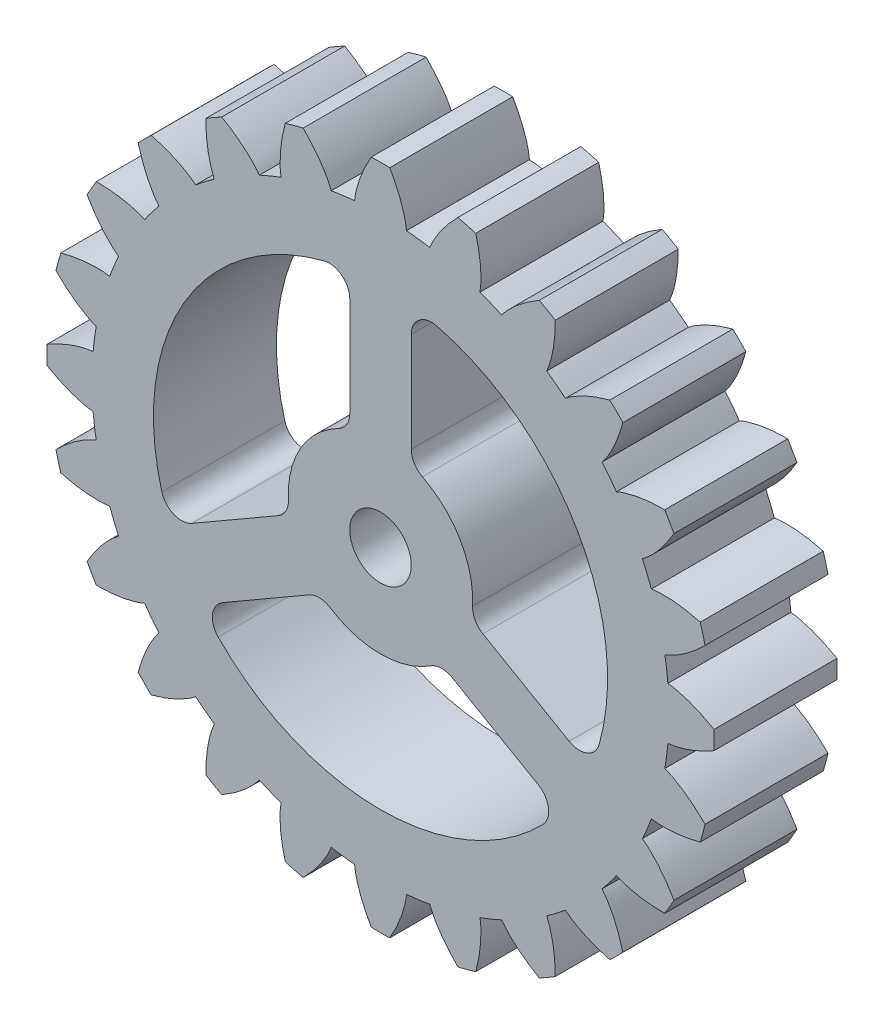
from build123d import *
from build123d.topology import SkipClean

# Parameters (mm, degrees)
SKETCH5_R            = 14.078874537
SKETCH5_R_2          = 1.5
EXTRUDE_BODY_DEPTH   = 3
EXTRUDE_TOOTH_DEPTH  = 3
CIRPATTERN1_COUNT    = 24
CUT_SPOKE_DEPTH      = 24.21644933
PATTERN_SPOKES_COUNT = 3


with BuildPart() as part:
    # Sketch5 → Extrude Body (new, symmetric)
    with BuildSketch(Plane.XY):
        Circle(SKETCH5_R)
        Circle(SKETCH5_R_2, mode=Mode.SUBTRACT)
    extrude(amount=EXTRUDE_BODY_DEPTH, both=True)

    # Sketch6 → Extrude Tooth (add, symmetric)
    with BuildSketch(Plane.XY):
        with BuildLine():
            Line((1.274269027, 13.788607604), (0.138033757, 1.493635391))
            ThreePointArc((0.138033757, 1.493635391), (0, 1.5), (-0.138033757, 1.493635391))
            Line((-0.138033757, 1.493635391), (-1.274269027, 13.788607604))
            add(Edge.make_bspline(
                [(-1.274269027, 13.788607604), (-1.281655886, 14.009204475), (-1.145793676, 14.886152234), (-0.779387603, 15.700986555), (-0.45055771, 16.272638198)],
                knots=[0, 0, 0, 0, 0.250018961, 1, 1, 1, 1], degree=3))
            ThreePointArc((-0.45055771, 16.272638198), (0, 16.278874537), (0.45055771, 16.272638198))
            add(Edge.make_bspline(
                [(1.274269027, 13.788607604), (1.281655886, 14.009204475), (1.145793676, 14.886152234), (0.779387603, 15.700986555), (0.45055771, 16.272638198)],
                knots=[0, 0, 0, 0, 0.250018961, 1, 1, 1, 1], degree=3))
        make_face()
    extrude_tooth = extrude(amount=EXTRUDE_TOOTH_DEPTH, both=True)

    # CirPattern1: Extrude Tooth ×24 about axis
    with SkipClean():  # the faces are left unmerged after this step: merging them gives an invalid solid
        cirpattern1_axis = Axis((0, 0, 3), (0, 0, -1))
        for i in range(1, CIRPATTERN1_COUNT):
            add(extrude_tooth.rotate(cirpattern1_axis, i * 360 / CIRPATTERN1_COUNT))

    # Sketch8 → Cut Spoke (cut, symmetric)
    with SkipClean():  # the faces are left unmerged after this step: merging them gives an invalid solid
        with BuildSketch(Plane.XY):
            with BuildLine():
                Line((1.5, 9.763898398), (1.5, 4.898979486))
                ThreePointArc((1.5, 4.898979486), (1.647197135, 4.376746518), (2.045454545, 4.008255943))
                ThreePointArc((2.045454545, 4.008255943), (3.897114317, 2.25), (4.493978744, -0.232712373))
                ThreePointArc((4.493978744, -0.232712373), (4.613972238, -0.761858695), (4.992640687, -1.150451637))
                Line((4.992640687, -1.150451637), (9.205784053, -3.582911093))
                ThreePointArc((9.205784053, -3.582911093), (10.083315936, -3.642882276), (10.668766975, -2.986448098))
                ThreePointArc((10.668766975, -2.986448098), (9.594586794, 5.539437268), (2.748043568, 10.732647276))
                ThreePointArc((2.748043568, 10.732647276), (1.886829374, 10.553848893), (1.5, 9.763898398))
            make_face()
        cut_spoke = extrude(amount=CUT_SPOKE_DEPTH, both=True, mode=Mode.SUBTRACT)

    # Pattern Spokes: Cut Spoke ×3 about axis
    with SkipClean():  # the faces are left unmerged after this step: merging them gives an invalid solid
        pattern_spokes_axis = Axis((0, 0, 0), (0, 0, 1))
        for i in range(1, PATTERN_SPOKES_COUNT):
            add(cut_spoke.rotate(pattern_spokes_axis, i * 360 / PATTERN_SPOKES_COUNT), mode=Mode.SUBTRACT)


solid = part.part
